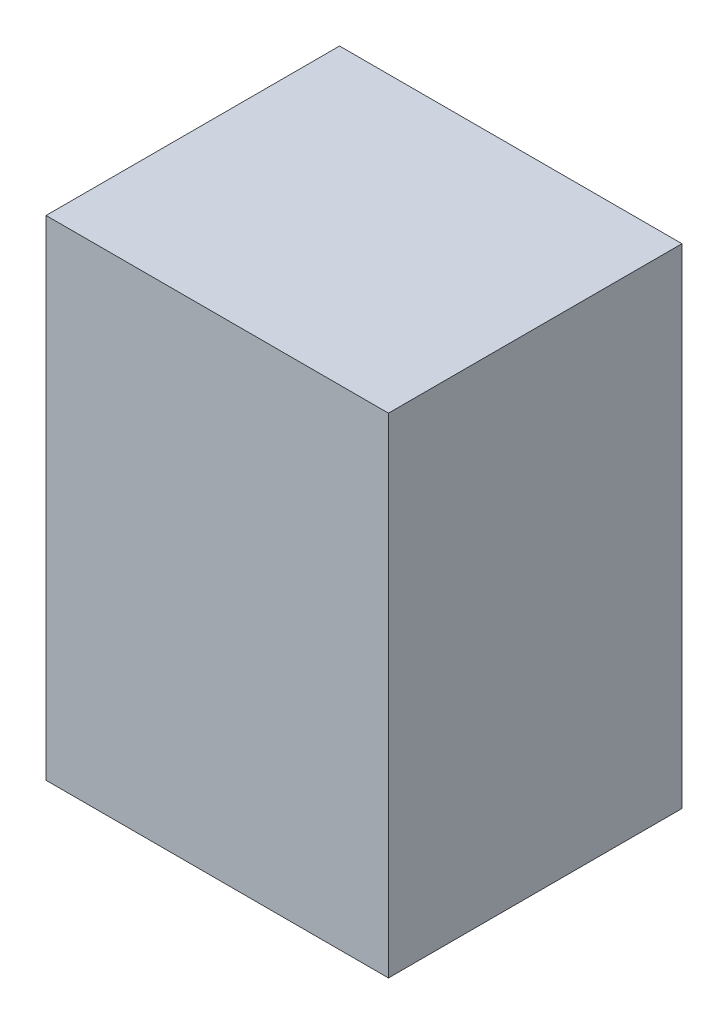
from build123d import *

# Parameters (mm, degrees)
SKETCH1_W           = 35
SKETCH1_H           = 50
BOSS_EXTRUDE1_DEPTH = 30


with BuildPart() as part:
    # Sketch1 → Boss-Extrude1 (new body)
    with BuildSketch(Plane.XY):
        Rectangle(SKETCH1_W, SKETCH1_H)
    extrude(amount=BOSS_EXTRUDE1_DEPTH)


solid = part.part
